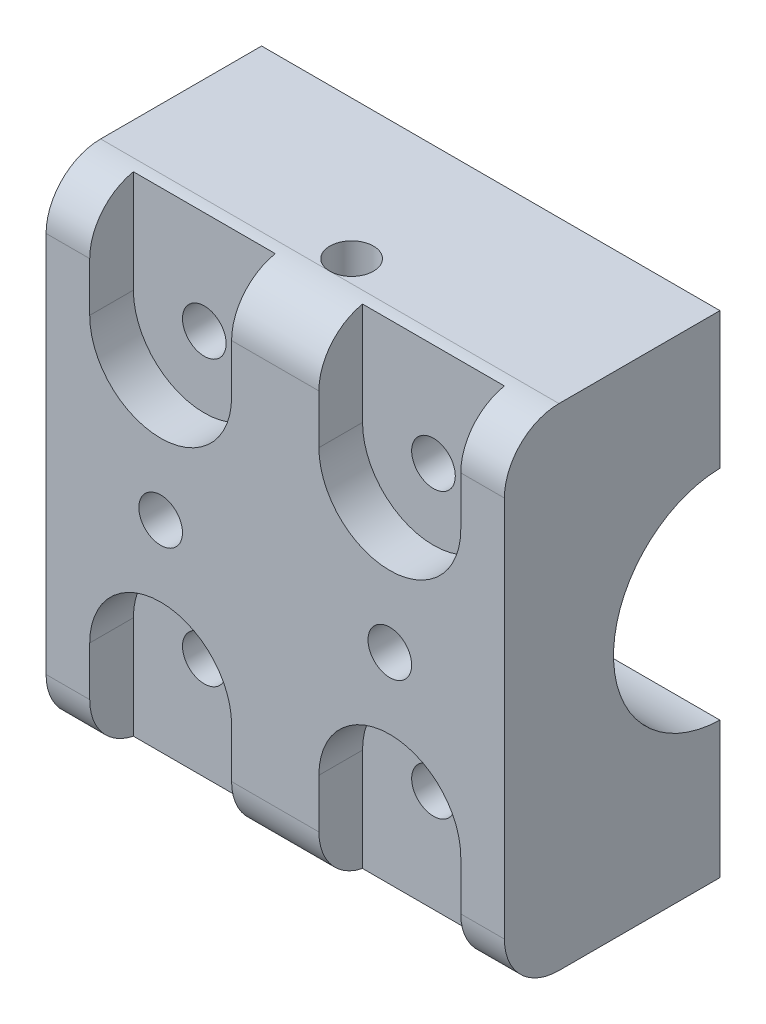
from build123d import *

# Parameters (mm, degrees)
BOSS_EXTRUDE1_DEPTH = 42
SKETCH2_R           = 2
CUT_EXTRUDE2_DEPTH  = 52.578217301
CUT_EXTRUDE3_DEPTH  = 4
SKETCH4_R           = 2
CUT_EXTRUDE4_DEPTH  = 52.578217301
SKETCH5_R           = 2
CUT_EXTRUDE5_DEPTH  = 65.722484597


with BuildPart() as part:
    # Sketch1 → Boss-Extrude1 (new body)
    with BuildSketch(Plane(origin=(0, 0, 0), x_dir=(0, 0, -1), z_dir=(1, 0, 0))):
        with BuildLine():
            Line((-0.25, 9.996874512), (-0.25, 22.5))
            Line((-0.25, 22.5), (-15, 22.5))
            ThreePointArc((-15, 22.5), (-18.535533906, 21.035533906), (-20, 17.5))
            Line((-20, 17.5), (-20, -17.5))
            ThreePointArc((-20, -17.5), (-18.535533906, -21.035533906), (-15, -22.5))
            Line((-15, -22.5), (-0.25, -22.5))
            Line((-0.25, -22.5), (-0.25, -9.996874512))
            ThreePointArc((-0.25, -9.996874512), (-10, 0), (-0.25, 9.996874512))
        make_face()
    extrude(amount=-BOSS_EXTRUDE1_DEPTH)

    # Sketch2 → Cut-Extrude2 (cut, through all)
    with BuildSketch(Plane.XY.offset(0.25)):
        with Locations(Location((-10.5, 13, 0), (0, 0, 90))):
            Circle(SKETCH2_R)
        with Locations(Location((-31.5, 13, 0), (0, 0, 90))):
            Circle(SKETCH2_R)
        with Locations(Location((-31.5, -13, 0), (0, 0, 90))):
            Circle(SKETCH2_R)
        with Locations(Location((-10.5, -13, 0), (0, 0, 90))):
            Circle(SKETCH2_R)
    extrude(amount=CUT_EXTRUDE2_DEPTH, mode=Mode.SUBTRACT)

    # Sketch3 → Cut-Extrude3 (cut)
    with BuildSketch(Plane.XY.offset(20)):
        with BuildLine():
            Line((-38, 13), (-38, 22.5))
            Line((-38, 22.5), (-25, 22.5))
            Line((-25, 22.5), (-25, 13))
            ThreePointArc((-25, 13), (-31.5, 6.5), (-38, 13))
        make_face()
        with BuildLine():
            Line((-17, 13), (-17, 22.5))
            Line((-17, 22.5), (-4, 22.5))
            Line((-4, 22.5), (-4, 13))
            ThreePointArc((-4, 13), (-10.5, 6.5), (-17, 13))
        make_face()
        with BuildLine():
            Line((-4, -22.5), (-4, -13))
            ThreePointArc((-4, -13), (-10.5, -6.5), (-17, -13))
            Line((-17, -13), (-17, -22.5))
            Line((-17, -22.5), (-4, -22.5))
        make_face()
        with BuildLine():
            Line((-25, -22.5), (-25, -13))
            ThreePointArc((-25, -13), (-31.5, -6.5), (-38, -13))
            Line((-38, -13), (-38, -22.5))
            Line((-38, -22.5), (-25, -22.5))
        make_face()
    extrude(amount=-CUT_EXTRUDE3_DEPTH, mode=Mode.SUBTRACT)

    # Sketch4 → Cut-Extrude4 (cut, through all)
    with BuildSketch(Plane.XY.offset(20)):
        with Locations((-10.5, 0)):
            Circle(SKETCH4_R)
        with Locations((-31.5, 0)):
            Circle(SKETCH4_R)
    extrude(amount=-CUT_EXTRUDE4_DEPTH, mode=Mode.SUBTRACT)

    # Sketch5 → Cut-Extrude5 (cut, through all)
    with BuildSketch(Plane.XZ.offset(22.5)):
        with Locations(Location((-21, 13, 0), (0, 0, 90))):
            Circle(SKETCH5_R)
    extrude(amount=-CUT_EXTRUDE5_DEPTH, mode=Mode.SUBTRACT)


solid = part.part
